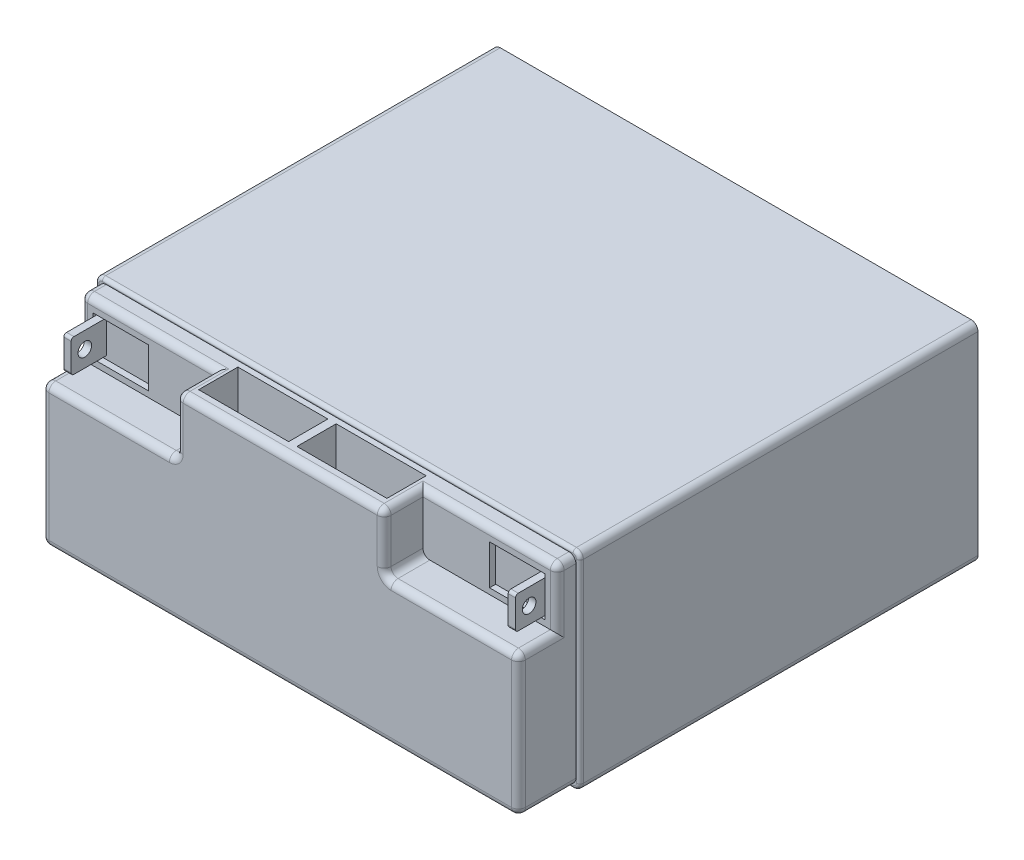
from build123d import *

# Parameters (mm, degrees)
SKETCH_1_W             = 177.8
SKETCH_1_H             = 146.05
EXTRUDE_1_DEPTH        = 76.2
SKETCH_2_W             = 174.845239449
SKETCH_2_H             = 73.245239449
EXTRUDE_2_DEPTH        = 21.082
SKETCH_3_W             = 49.276
SKETCH_3_H             = 14.224
CUT_EXTRUDE_1_DEPTH    = 21.336
SKETCH_4_W             = 2.693561453
SKETCH_4_H             = 12
EXTRUDE_3_DEPTH        = 10.746
CUT_EXTRUDE_2_DEPTH    = 2.254
SKETCH_6_W             = 49.276
SKETCH_6_H             = 21.336
CUT_EXTRUDE_3_DEPTH    = 14.224
SKETCH_7_W             = 2.693561452
SKETCH_7_H             = 12
EXTRUDE_4_DEPTH        = 10.746
CUT_EXTRUDE_4_DEPTH    = 2.254
SKETCH_9_W             = 33.02
SKETCH_9_H             = 14.399652357
CUT_EXTRUDE_5_DEPTH    = 19.05
SKETCH_10_W            = 33.02
SKETCH_10_H            = 14.399652357
CUT_EXTRUDE_6_DEPTH    = 19.05
SKETCH_11_W            = 63.5
SKETCH_11_H            = 15.201284342
CUT_EXTRUDE_7_DEPTH    = 19.558
SKETCH_12_W            = 63.5
SKETCH_12_H            = 15.201284342
CUT_EXTRUDE_8_DEPTH    = 19.558
HOLE_WIZARD_10_1_D     = 5
HOLE_WIZARD_10_1_DEPTH = 8.734014926
HOLE_WIZARD_10_2_D     = 5
HOLE_WIZARD_10_2_DEPTH = 8.734014926
FILLET_1_R             = 2.54
FILLET_2_R             = 1
FILLET_3_R             = 1.27


with BuildPart() as part:
    # 草圖1 → 填料-伸長1 (new body)
    with BuildSketch(Plane.XZ.offset(62.213215728)):
        with Locations((55.786931477, 73.025)):
            Rectangle(SKETCH_1_W, SKETCH_1_H)
    extrude(amount=-EXTRUDE_1_DEPTH)

    # 草圖2 → 填料-伸長2 (add)
    with BuildSketch(Plane.XY.offset(146.05)):
        with Locations((55.786931477, -24.113215728)):
            Rectangle(SKETCH_2_W, SKETCH_2_H)
    extrude(amount=EXTRUDE_2_DEPTH)

    # 草圖3 → 除料-伸長1 (cut)
    with BuildSketch(Plane(origin=(0, 12.509403997, 0), x_dir=(-1, 0, 0), z_dir=(0, 1, 0))):
        with Locations((6.997688247, 160.02)):
            Rectangle(SKETCH_3_W, SKETCH_3_H)
    extrude(amount=-CUT_EXTRUDE_1_DEPTH, mode=Mode.SUBTRACT)

    # 草圖4 → 填料-伸長3 (add)
    with BuildSketch(Plane.XY.offset(152.908)):
        with Locations((-25.725834324, 0.632623113)):
            Rectangle(SKETCH_4_W, SKETCH_4_H)
    extrude(amount=EXTRUDE_3_DEPTH)

    # 草圖5 → 除料-伸長2 (cut)
    with BuildSketch(Plane.XY.offset(152.908)):
        Polygon((-6.787176985, -6.677584717), (-6.787176985, 7.942830943), (-27.07261505, 7.942830943), (-27.07261505, 6.632623113), (-24.379053597, 6.632623113), (-24.379053597, -5.367376887), (-27.07261505, -5.367376887), (-27.07261505, -6.677584717), align=None)
    extrude(amount=-CUT_EXTRUDE_2_DEPTH, mode=Mode.SUBTRACT)

    # 草圖6 → 除料-伸長3 (cut)
    with BuildSketch(Plane.XY.offset(167.132)):
        with Locations((118.571551202, 1.841403997)):
            Rectangle(SKETCH_6_W, SKETCH_6_H)
    extrude(amount=-CUT_EXTRUDE_3_DEPTH, mode=Mode.SUBTRACT)

    # 草圖7 → 填料-伸長4 (add)
    with BuildSketch(Plane.XY.offset(152.908)):
        with Locations((137.299697278, 0.632623113)):
            Rectangle(SKETCH_7_W, SKETCH_7_H)
    extrude(amount=EXTRUDE_4_DEPTH)

    # 草圖8 → 除料-伸長4 (cut)
    with BuildSketch(Plane.XY.offset(152.908)):
        Polygon((118.361039939, 7.942830943), (118.361039939, -6.677584717), (138.646478004, -6.677584717), (138.646478004, -5.367376887), (135.952916552, -5.367376887), (135.952916552, 6.632623113), (138.646478004, 6.632623113), (138.646478004, 7.942830943), align=None)
    extrude(amount=-CUT_EXTRUDE_4_DEPTH, mode=Mode.SUBTRACT)

    # 草圖9 → 除料-伸長5 (cut)
    with BuildSketch(Plane(origin=(0, 12.509403997, 0), x_dir=(-1, 0, 0), z_dir=(0, 1, 0))):
        with Locations((-37.752931477, 155.313650768)):
            Rectangle(SKETCH_9_W, SKETCH_9_H)
    extrude(amount=-CUT_EXTRUDE_5_DEPTH, mode=Mode.SUBTRACT)

    # 草圖10 → 除料-伸長6 (cut)
    with BuildSketch(Plane(origin=(0, 12.509403997, 0), x_dir=(-1, 0, 0), z_dir=(0, 1, 0))):
        with Locations((-73.820931477, 155.313650768)):
            Rectangle(SKETCH_10_W, SKETCH_10_H)
    extrude(amount=-CUT_EXTRUDE_6_DEPTH, mode=Mode.SUBTRACT)

    # 草圖11 → 除料-伸長7 (cut)
    with BuildSketch(Plane.XZ.offset(60.735835452)):
        with Locations((22.974311753, 155.2427389)):
            Rectangle(SKETCH_11_W, SKETCH_11_H)
    extrude(amount=-CUT_EXTRUDE_7_DEPTH, mode=Mode.SUBTRACT)

    # 草圖12 → 除料-伸長8 (cut)
    with BuildSketch(Plane.XZ.offset(60.735835452)):
        with Locations((88.599551202, 155.2427389)):
            Rectangle(SKETCH_12_W, SKETCH_12_H)
    extrude(amount=-CUT_EXTRUDE_8_DEPTH, mode=Mode.SUBTRACT)

    # #10 餘隙孔1
    with Locations(Plane(origin=(-24.379053597, 0, 0), x_dir=(0, 0, -1), z_dir=(1, 0, 0))):
        with Locations((-158.654, 0.632623113)):
            Hole(HOLE_WIZARD_10_1_D / 2, depth=HOLE_WIZARD_10_1_DEPTH)

    # #10 餘隙孔2
    with Locations(Plane.ZY.offset(-135.952916552)):
        with Locations((158.654, 0.632623113)):
            Hole(HOLE_WIZARD_10_2_D / 2, depth=HOLE_WIZARD_10_2_DEPTH)

    # 圓角1
    fillet_1_edges = [part.edges().sort_by_distance(p)[0] for p in [
        (-33.113068523, 13.986784272, 73.025),
        (143.209551202, -60.735835452, 156.591),
        (-31.635688247, -60.735835452, 156.591),
        (143.209551202, -34.781215728, 167.132),
        (55.786931477, -60.735835452, 167.132),
        (-31.635688247, -34.781215728, 167.132),
        (-31.635688247, 12.509403997, 149.479),
        (-31.635688247, -8.826596003, 160.02),
        (-31.635688247, 1.841403997, 152.908),
        (17.640311753, -8.826596003, 160.02),
        (-6.997688247, -8.826596003, 167.132),
        (17.640311753, 1.841403997, 167.132),
        (17.640311753, 12.509403997, 160.02),
        (-6.997688247, 12.509403997, 152.908),
        (144.686931477, 13.986784272, 73.025),
        (-33.113068523, -62.213215728, 73.025),
        (144.686931477, -62.213215728, 73.025),
        (55.786931477, 12.509403997, 167.132),
        (143.209551202, 12.509403997, 149.479),
        (118.571551202, 12.509403997, 152.908),
        (93.933551202, 12.509403997, 160.02),
        (143.209551202, 1.841403997, 152.908),
        (143.209551202, -8.826596003, 160.02),
        (93.933551202, -8.826596003, 160.02),
        (93.933551202, 1.841403997, 167.132),
        (118.571551202, -8.826596003, 167.132),
    ]]
    fillet(fillet_1_edges, radius=FILLET_1_R)

    # 圓角2
    fillet_2_edges = [part.edges().sort_by_distance(p)[0] for p in [
        (-25.725834323, -5.367376887, 163.654),
        (-25.725834323, 6.632623113, 163.654),
        (137.299697278, 6.632623113, 163.654),
        (137.299697278, -5.367376887, 163.654),
    ]]
    fillet(fillet_2_edges, radius=FILLET_2_R)

    # 圓角3
    fillet_3_edges = [part.edges().sort_by_distance(p)[0] for p in [
        (-33.113068523, -24.113215728, 146.05),
        (55.786931477, 13.986784272, 146.05),
        (55.786931477, -62.213215728, 146.05),
        (144.686931477, -24.113215728, 146.05),
        (143.942982701, 13.242835496, 146.05),
        (143.942982701, -61.469266952, 146.05),
        (-32.369119747, -61.469266952, 146.05),
        (-32.369119747, 13.242835496, 146.05),
    ]]
    fillet(fillet_3_edges, radius=FILLET_3_R)


solid = part.part
